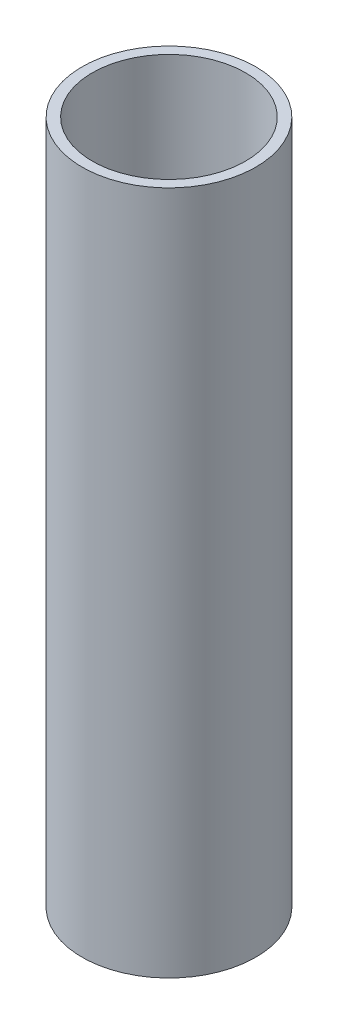
from build123d import *

# Parameters (mm, degrees)
SKETCH1_W = 1.5
SKETCH1_H = 100


with BuildPart() as part:
    # Sketch1 → Revolve1 (revolve)
    with BuildSketch(Plane.XY, mode=Mode.PRIVATE) as revolve1_sk:
        with Locations((11.95, -50)):
            Rectangle(SKETCH1_W, SKETCH1_H)
    revolve(revolve1_sk.sketch.rotate(Axis((0, -200, 0), (0, 1, 0)), 90), axis=Axis((0, -200, 0), (0, 1, 0)))


solid = part.part
